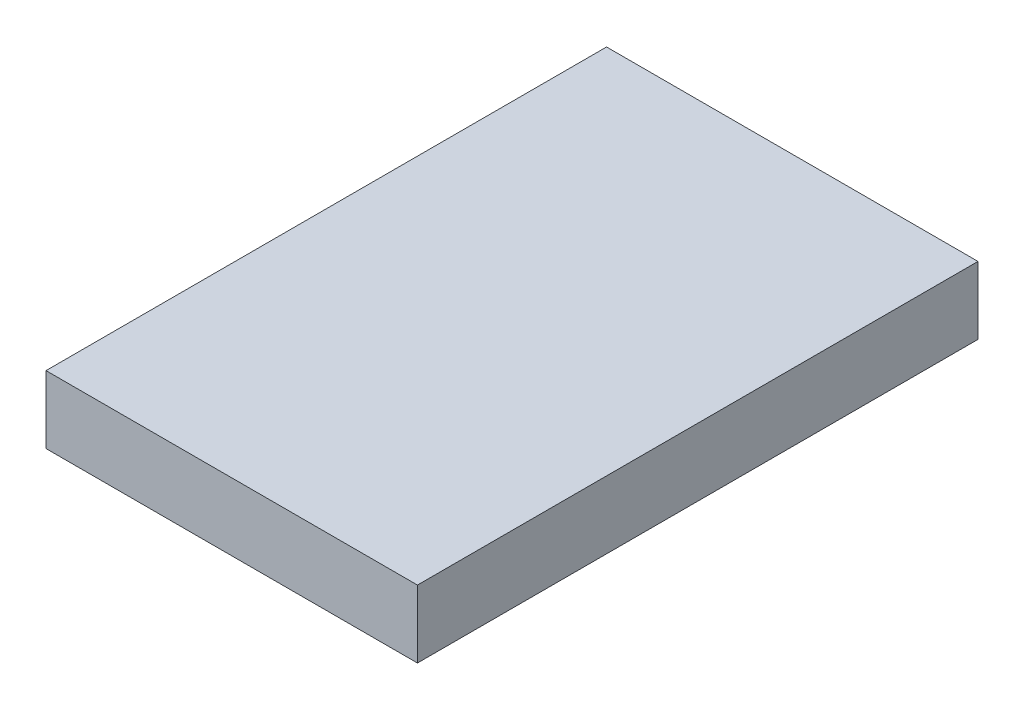
from build123d import *

# Parameters (mm, degrees)
SKETCH1_W           = 55
SKETCH1_H           = 83
BOSS_EXTRUDE1_DEPTH = 10


with BuildPart() as part:
    # Sketch1 → Boss-Extrude1 (new body)
    with BuildSketch(Plane(origin=(0, 0, 0), x_dir=(1, 0, 0), z_dir=(0, 1, 0))):
        Rectangle(SKETCH1_W, SKETCH1_H)
    extrude(amount=BOSS_EXTRUDE1_DEPTH)


solid = part.part
